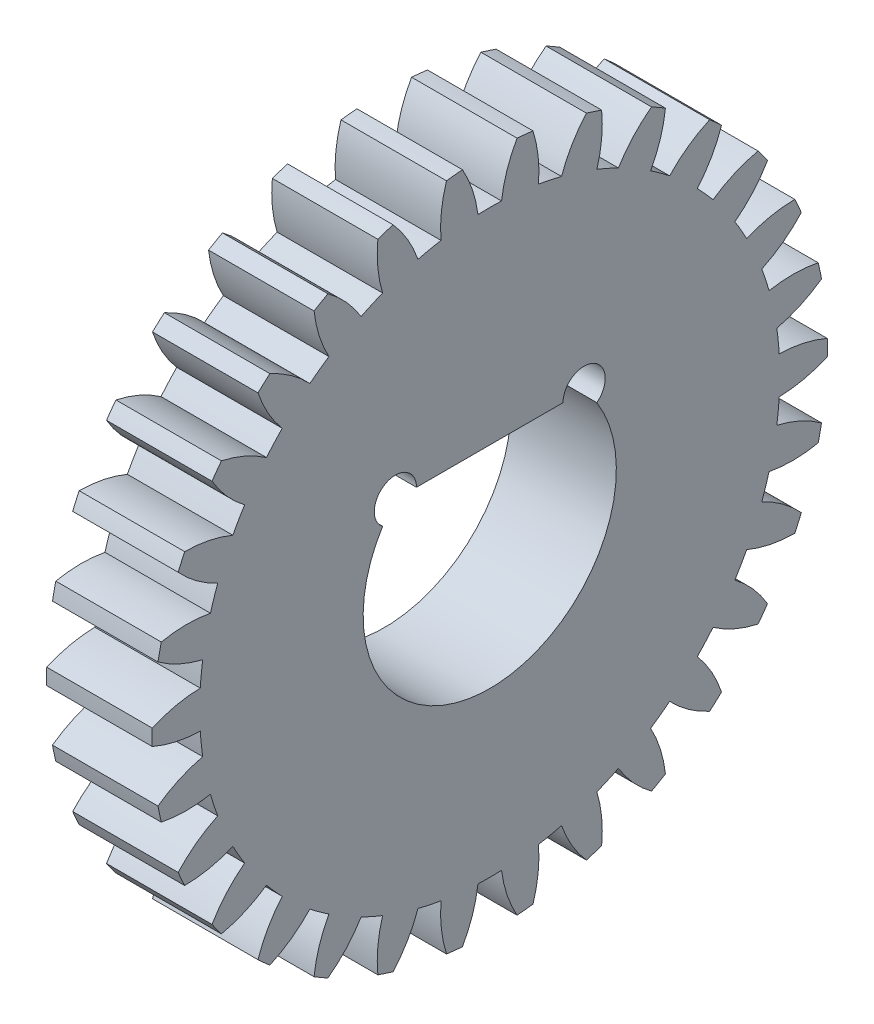
from build123d import *

# Parameters (mm, degrees)
BASPROSKE_W         = 2.5
BASPROSKE_H         = 8
TOOTHCUT_DEPTH      = 12.586630226
TEETHCUTS_COUNT     = 30
TEETHCUTS_ANGLE     = 348
BORSKE_R            = 3
BORE_DEPTH          = 50.0000508
EXTRUDE_1_DEPTH     = 2.5
SKETCH_2_R          = 0.5
CUT_EXTRUDE_1_DEPTH = 12.568528524


with BuildPart() as part:
    # BasProSke → Base-Revolve (revolve)
    with BuildSketch(Plane(origin=(0, 0, 0), x_dir=(1, 0, 0), z_dir=(0, 1, 0)), mode=Mode.PRIVATE) as base_revolve_sk:
        with Locations((1.25, 4)):
            Rectangle(BASPROSKE_W, BASPROSKE_H)
    revolve(base_revolve_sk.sketch.rotate(Axis((-10, 0, 0), (1, 0, 0)), 180), axis=Axis((-10, 0, 0), (1, 0, 0)))

    # TooCutSke → ToothCut (cut, through all)
    with BuildSketch(Plane(origin=(0, 0, 0), x_dir=(0, 0, -1), z_dir=(1, 0, 0))):
        with BuildLine():
            ThreePointArc((0.279013782, 6.868335119), (0, 6.874), (-0.279013782, 6.868335119))
            ThreePointArc((-0.279013782, 6.868335119), (-0.413500328, 7.452412324), (-0.661410108, 7.998098638))
            ThreePointArc((-0.661410108, 7.998098638), (0, 8.0254), (0.661410108, 7.998098638))
            ThreePointArc((0.661410108, 7.998098638), (0.413500328, 7.452412324), (0.279013782, 6.868335119))
        make_face()
    toothcut = extrude(amount=TOOTHCUT_DEPTH, mode=Mode.SUBTRACT)

    # TeethCuts: ToothCut ×30 about axis
    teethcuts_axis = Axis((-10, 0, 0), (1, 0, 0))
    for i in range(1, TEETHCUTS_COUNT):
        add(toothcut.rotate(teethcuts_axis, i * TEETHCUTS_ANGLE / (TEETHCUTS_COUNT - 1)), mode=Mode.SUBTRACT)

    # BorSke → Bore (cut, symmetric)
    with BuildSketch(Plane(origin=(0, 0, 0), x_dir=(0, 0, -1), z_dir=(1, 0, 0))):
        with Locations(Location((0, 0, 0), (0, 0, 180))):
            Circle(BORSKE_R)
    extrude(amount=BORE_DEPTH, both=True, mode=Mode.SUBTRACT)

    # 草图1 → 凸台-拉伸1 (add, through all)
    with BuildSketch(Plane(origin=(2.5, 0, 0), x_dir=(0, 0, -1), z_dir=(1, 0, 0))):
        with BuildLine():
            Line((-2.236067977, 2), (2.236067977, 2))
            ThreePointArc((2.236067977, 2), (0, 3), (-2.236067977, 2))
        make_face()
    extrude(amount=-EXTRUDE_1_DEPTH)

    # 草图2 → 切除-拉伸1 (cut, through all)
    with BuildSketch(Plane(origin=(2.5, 0, 0), x_dir=(0, 0, -1), z_dir=(1, 0, 0))):
        with Locations((2.236067977, 2)):
            Circle(SKETCH_2_R)
        with Locations((-2.236067977, 2)):
            Circle(SKETCH_2_R)
    extrude(amount=-CUT_EXTRUDE_1_DEPTH, mode=Mode.SUBTRACT)


solid = part.part
